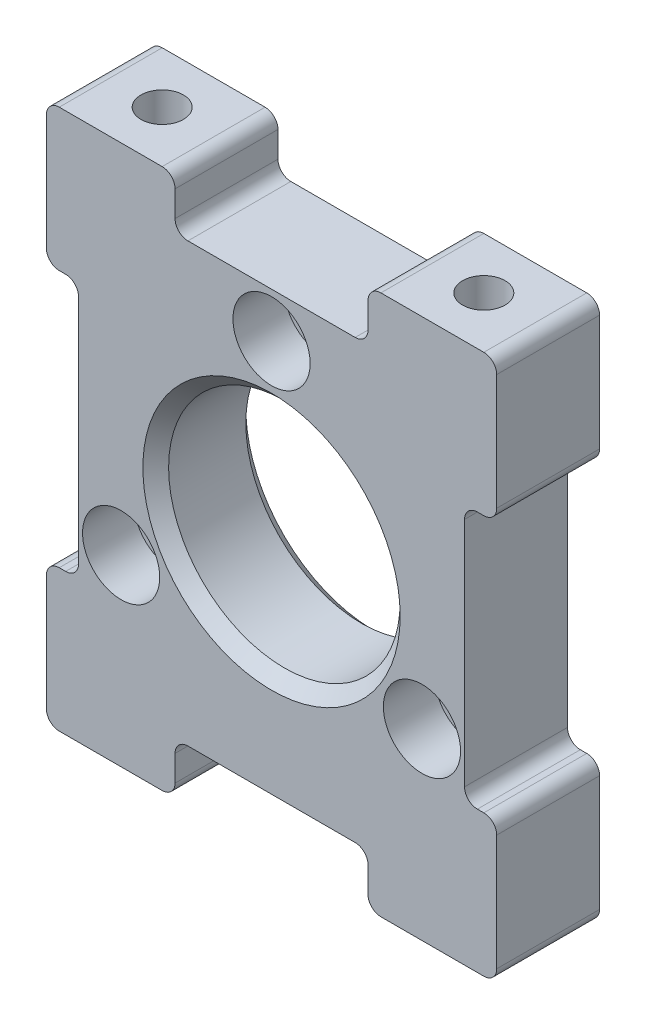
from build123d import *

# Parameters (mm, degrees)
SKETCH_1_W                  = 35
SKETCH_1_H                  = 42
EXTRUDE_1_DEPTH             = 4
SKETCH_2_R                  = 1.5
SKETCH_2_R_2                = 9
CUT_EXTRUDE_1_DEPTH         = 8
SKETCH_3_R                  = 3
CUT_EXTRUDE_2_DEPTH         = 4
HOLE_WIZARD_M4_1_AT_2_COUNT = 2
HOLE_WIZARD_M4_1_AT_2_PITCH = 25
SKETCH_9_R                  = 2
CUT_EXTRUDE_3_DEPTH         = 5.1
CUT_EXTRUDE_4_DEPTH         = 29.482450737
CUT_EXTRUDE_4_DEPTH_BACK    = 29.482450737
SKETCH_10_W                 = 15
SKETCH_10_H                 = 8
SKETCH_10_W_2               = 5
SKETCH_10_H_2               = 20
FILLET_2_R                  = 1
CHAMFER_1_SIZE              = 1


with BuildPart() as part:
    # 草图1 → 凸台-拉伸1 (new, symmetric)
    with BuildSketch(Plane.XY):
        Rectangle(SKETCH_1_W, SKETCH_1_H)
    extrude(amount=EXTRUDE_1_DEPTH, both=True)

    # 草图2 → 切除-拉伸1 (cut)
    with BuildSketch(Plane.XY.offset(4)):
        with Locations((0, 13.5)):
            Circle(SKETCH_2_R)
        with Locations((11.691342951, -6.75)):
            Circle(SKETCH_2_R)
        with Locations((-11.691342951, -6.75)):
            Circle(SKETCH_2_R)
        Circle(SKETCH_2_R_2)
    extrude(amount=-CUT_EXTRUDE_1_DEPTH, mode=Mode.SUBTRACT)

    # 草图3 → 切除-拉伸2 (cut)
    with BuildSketch(Plane.XY.offset(4)):
        with Locations((-11.691342951, -6.75)):
            Circle(SKETCH_3_R)
        with Locations((11.691342951, -6.75)):
            Circle(SKETCH_3_R)
        with Locations((0, 13.5)):
            Circle(SKETCH_3_R)
    extrude(amount=-CUT_EXTRUDE_2_DEPTH, mode=Mode.SUBTRACT)

    # 草图8 → M4 螺纹孔1 (revolve, cut)
    with BuildSketch(Plane(origin=(-12.5, 21, 0), x_dir=(0, 0, 1), z_dir=(1, 0, 0))):
        Polygon((0, 0), (0, 10.991420021), (1.65, 10), (1.65, 0), align=None)
    hole_wizard_m4_1 = revolve(axis=Axis((-12.5, 27.35, 0), (0, -1, 0)), mode=Mode.SUBTRACT)

    # M4 螺纹孔1 at 2: M4 螺纹孔1 ×2
    with Locations(*[(i * HOLE_WIZARD_M4_1_AT_2_PITCH, 0, 0) for i in range(1, HOLE_WIZARD_M4_1_AT_2_COUNT)]):
        add(hole_wizard_m4_1, mode=Mode.SUBTRACT)

    # 镜向1: M4 螺纹孔1 across plane
    add(hole_wizard_m4_1.mirror(Plane.ZX), mode=Mode.SUBTRACT)

    # 镜向1 copy 1 sketch → 镜向1 copy 1 (revolve, cut)
    with BuildSketch(Plane(origin=(12.5, -21, 0), x_dir=(0, 0, 1), z_dir=(1, 0, 0))):
        Polygon((0, 0), (0, -10.991420021), (1.65, -10), (1.65, 0), align=None)
    revolve(axis=Axis((12.5, -27.35, 0), (0, -1, 0)), mode=Mode.SUBTRACT)

    # 草图9 → 切除-拉伸3 (cut)
    with BuildSketch(Plane(origin=(0, 0, -4), x_dir=(-1, 0, 0), z_dir=(0, 0, -1))):
        with Locations((0, -12.15)):
            Circle(SKETCH_9_R)
        with Locations((-10.522208656, 6.075)):
            Circle(SKETCH_9_R)
        with Locations((10.522208656, 6.075)):
            Circle(SKETCH_9_R)
    extrude(amount=-CUT_EXTRUDE_3_DEPTH, mode=Mode.SUBTRACT)

    # 草图10 → 切除-拉伸4 (cut, two sides: drawn at the far end of the back side and taken through both)
    with BuildSketch(Plane(origin=(0, 0, -4), x_dir=(-1, 0, 0), z_dir=(0, 0, -1)).offset(-CUT_EXTRUDE_4_DEPTH_BACK)):
        with Locations((0, 21)):
            Rectangle(SKETCH_10_W, SKETCH_10_H)
        with Locations((0, -21)):
            Rectangle(SKETCH_10_W, SKETCH_10_H)
        with Locations((17.5, 0)):
            Rectangle(SKETCH_10_W_2, SKETCH_10_H_2)
        with Locations((-17.5, 0)):
            Rectangle(SKETCH_10_W_2, SKETCH_10_H_2)
    extrude(amount=CUT_EXTRUDE_4_DEPTH + CUT_EXTRUDE_4_DEPTH_BACK, mode=Mode.SUBTRACT)

    # 圆角2
    fillet_2_edges = [part.edges().sort_by_distance(p)[0] for p in [
        (-7.5, 21, 0),
        (-7.5, 17, 0),
        (7.5, 21, 0),
        (7.5, 17, 0),
        (-7.5, -21, 0),
        (-7.5, -17, 0),
        (7.5, -21, 0),
        (7.5, -17, 0),
        (-17.5, -10, 0),
        (-15, -10, 0),
        (-17.5, 10, 0),
        (-15, 10, 0),
        (15, 10, 0),
        (17.5, -10, 0),
        (15, -10, 0),
        (17.5, 10, 0),
        (17.5, -21, 0),
        (-17.5, -21, 0),
        (-17.5, 21, 0),
        (17.5, 21, 0),
    ]]
    fillet(fillet_2_edges, radius=FILLET_2_R)

    # 倒角1
    chamfer_1_edges = [part.edges().sort_by_distance(p)[0] for p in [
        (-9, 0, -4),
        (-9, 0, 4),
    ]]
    chamfer(chamfer_1_edges, length=CHAMFER_1_SIZE)


solid = part.part
